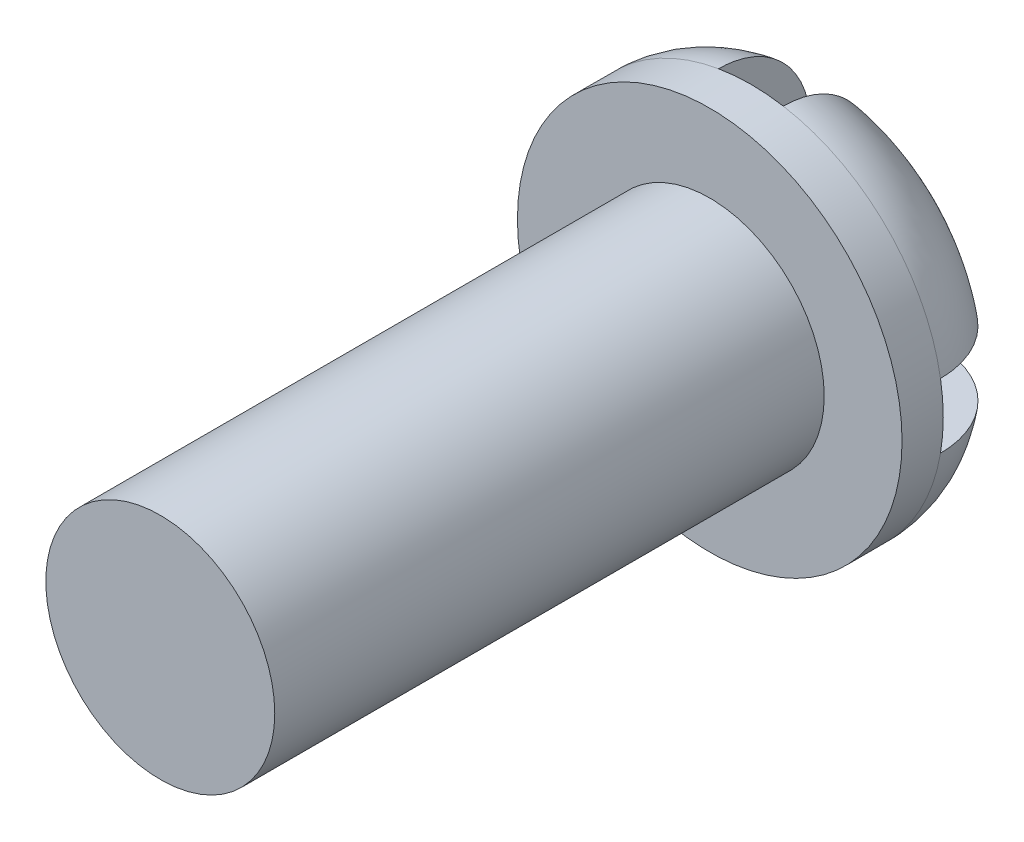
from build123d import *

# Parameters (mm, degrees)
SKETCH_1_R          = 2.5
EXTRUDE_1_DEPTH     = 12
SKETCH_2_R          = 4.2
EXTRUDE_2_DEPTH     = 2.9
FILLET_1_R          = 2
CUT_EXTRUDE_1_DEPTH = 2


with BuildPart() as part:
    # 草图1 → 凸台-拉伸1 (new body)
    with BuildSketch(Plane.XY):
        Circle(SKETCH_1_R)
    extrude(amount=EXTRUDE_1_DEPTH)

    # 草图2 → 凸台-拉伸2 (add)
    with BuildSketch(Plane(origin=(0, 0, 0), x_dir=(-1, 0, 0), z_dir=(0, 0, -1))):
        Circle(SKETCH_2_R)
    extrude(amount=EXTRUDE_2_DEPTH)

    # 圆角1
    fillet_1_edges = [part.edges().sort_by_distance(p)[0] for p in [
        (4.2, 0, -2.9),
    ]]
    fillet(fillet_1_edges, radius=FILLET_1_R)

    # 草图3 → 切除-拉伸1 (cut)
    with BuildSketch(Plane(origin=(0, 0, -2.9), x_dir=(-1, 0, 0), z_dir=(0, 0, -1))):
        Polygon((-0.707106781, 0.707106781), (-0.707106781, 6.006401657), (0.707106781, 6.006401657), (0.707106781, 0.707106781), (6.006401657, 0.707106781), (6.006401657, -0.707106781), (0.707106781, -0.707106781), (0.707106781, -6.006401657), (-0.707106781, -6.006401657), (-0.707106781, -0.707106781), (-6.006401657, -0.707106781), (-6.006401657, 0.707106781), align=None)
    extrude(amount=-CUT_EXTRUDE_1_DEPTH, mode=Mode.SUBTRACT)


solid = part.part
